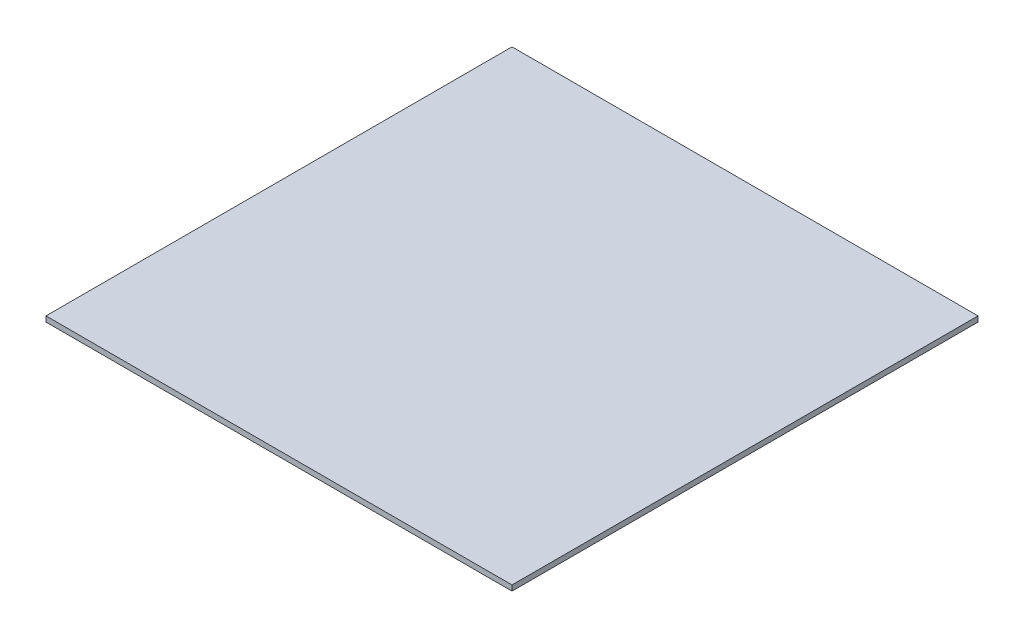
from build123d import *

# Parameters (mm, degrees)
SKETCH2_W           = 432
SKETCH2_H           = 432
BOSS_EXTRUDE1_DEPTH = 5


with BuildPart() as part:
    # Sketch2 → Boss-Extrude1 (new body)
    with BuildSketch(Plane(origin=(0, 0, 0), x_dir=(1, 0, 0), z_dir=(0, 1, 0))):
        with Locations((-4786.838709677, 2062.451612903)):
            Rectangle(SKETCH2_W, SKETCH2_H)
    extrude(amount=BOSS_EXTRUDE1_DEPTH)


solid = part.part
